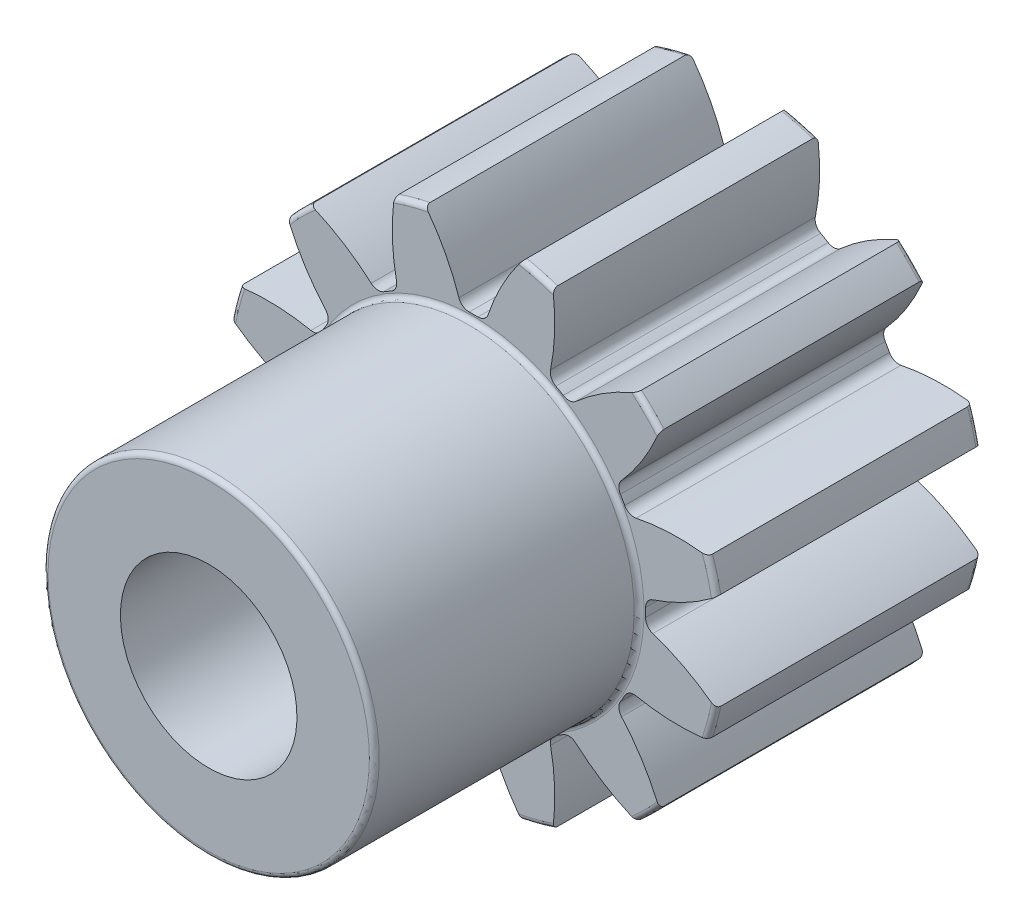
from build123d import *

# Parameters (mm, degrees)
FILLET2_R          = 0.17779999999999999
CUT_EXTRUDE2_DEPTH = 16.77307283879714
CIRPATTERN1_COUNT  = 12


with BuildPart() as part:
    # Sketch4 → Revolve1 (revolve)
    with BuildSketch(Plane(origin=(0, 0, 0), x_dir=(0, 0, -1), z_dir=(1, 0, 0))):
        Polygon((-19.05, 3.175), (-19.050000000000004, 5.9563), (-9.525000000000002, 5.9563), (-9.525, 8.889999999999999), (0, 8.889999999999999), (0, 3.175), align=None)
    revolve(axis=Axis((0, -3.9e-16, 9.525), (0, -1.2e-16, 1)))

    # Fillet2
    fillet2_edges = [part.edges().sort_by_distance(p)[0] for p in [
        (-1.09e-15, -8.889999999999999, -2.87e-15),
        (-1.09e-15, -8.889999999999999, 9.524999999999997),
        (-3.37e-15, -5.9563, 9.525000000000002),
        (-7.3e-16, -5.956300000000003, 19.050000000000004),
    ]]
    fillet(fillet2_edges, radius=FILLET2_R)

    # Sketch7 → Cut-Extrude2 (cut, through all)
    with BuildSketch(Plane.XY.offset(9.525000000000002)):
        with BuildLine():
            ThreePointArc((-0.15491933176584602, 6.189311477308701), (3.8e-16, 6.191249999999999), (0.15491933176584602, 6.189311477308701))
            ThreePointArc((0.15491933176584602, 6.189311477308701), (0.3832815496579799, 6.258296151850293), (0.5258680216652903, 6.449548043037629))
            ThreePointArc((0.5258680216652903, 6.449548043037629), (1.0371492684677657, 7.635350579575471), (1.741319400055545, 8.717792538652786))
            ThreePointArc((1.741319400055545, 8.717792538652786), (4.49e-15, 8.890000000000002), (-1.741319400055535, 8.717792538652791))
            ThreePointArc((-1.741319400055535, 8.717792538652791), (-1.0371492684677657, 7.635350579575471), (-0.5258680216652903, 6.449548043037629))
            ThreePointArc((-0.5258680216652903, 6.449548043037629), (-0.38328154965797995, 6.258296151850294), (-0.15491933176584602, 6.189311477308701))
        make_face()
    cut_extrude2 = extrude(amount=-CUT_EXTRUDE2_DEPTH, mode=Mode.SUBTRACT)

    # CirPattern1: Cut-Extrude2 ×12 about axis
    cirpattern1_axis = Axis((2.49e-15, -4e-17, 0), (0, 0, 1))
    for i in range(1, CIRPATTERN1_COUNT):
        add(cut_extrude2.rotate(cirpattern1_axis, i * 360 / CIRPATTERN1_COUNT), mode=Mode.SUBTRACT)


solid = part.part
